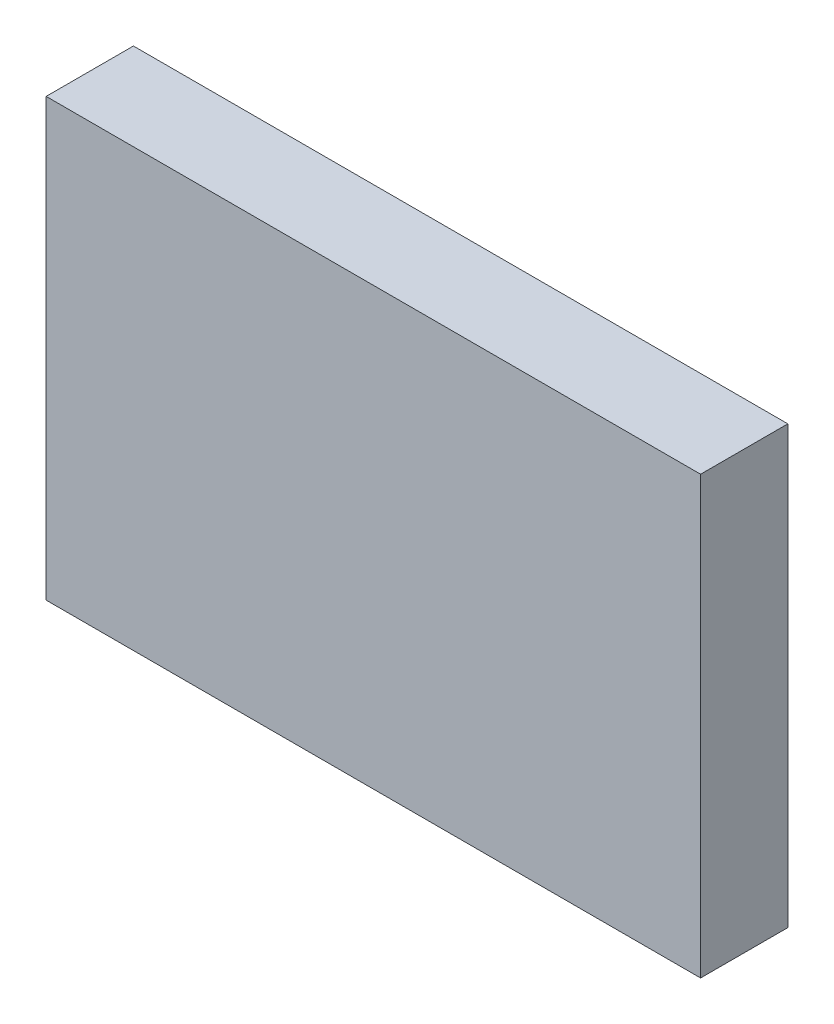
from build123d import *

# Parameters (mm, degrees)
CROQUIS1_W              = 60
CROQUIS1_H              = 40
SALIENTE_EXTRUIR1_DEPTH = 8


with BuildPart() as part:
    # Croquis1 → Saliente-Extruir1 (new body)
    with BuildSketch(Plane.XY):
        Rectangle(CROQUIS1_W, CROQUIS1_H)
    extrude(amount=SALIENTE_EXTRUIR1_DEPTH)


solid = part.part
